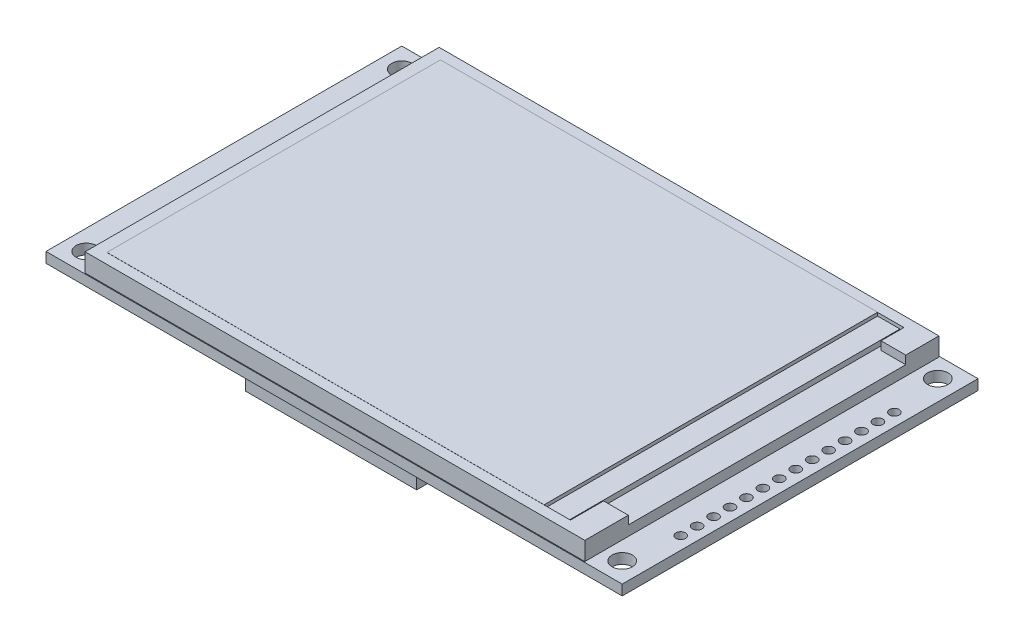
from build123d import *

# Parameters (mm, degrees)
ESQUISSE1_W             = 89.4
ESQUISSE1_H             = 55.2
ESQUISSE1_R             = 1.58
PLAQUE_DEPTH            = 1.6
ESQUISSE2_3_W           = 3.47
ESQUISSE2_3_H           = 51.74
NAPPE_DEPTH             = 2.35
BORDURE_DEPTH           = 2.85
ESQUISSE2_W             = 67.82
ESQUISSE2_H             = 51.74
LCD_DEPTH               = 2.87
SUPPORT_DEPTH           = 1.55
CARTE_SD_DEPTH          = 3
ESQUISSE5_R             = 0.75
ENL_V_MAT_EXTRU_1_DEPTH = 53.735282307


with BuildPart() as part:
    # Esquisse1 → Plaque (new body)
    with BuildSketch(Plane(origin=(0, 0, 0), x_dir=(1, 0, 0), z_dir=(0, 1, 0))):
        Rectangle(ESQUISSE1_W, ESQUISSE1_H)
        with Locations((-41.58, 24.48)):
            Circle(ESQUISSE1_R, mode=Mode.SUBTRACT)
        with Locations((41.58, 24.48)):
            Circle(ESQUISSE1_R, mode=Mode.SUBTRACT)
        with Locations((-41.58, -24.48)):
            Circle(ESQUISSE1_R, mode=Mode.SUBTRACT)
        with Locations((41.58, -24.48)):
            Circle(ESQUISSE1_R, mode=Mode.SUBTRACT)
    extrude(amount=PLAQUE_DEPTH)

    # Esquisse2<3> → Nappe (add)
    with BuildSketch(Plane(origin=(0, 1.6, 0), x_dir=(1, 0, 0), z_dir=(0, 1, 0))):
        with Locations((32.585, 0)):
            Rectangle(ESQUISSE2_3_W, ESQUISSE2_3_H)
    extrude(amount=NAPPE_DEPTH)

    # Esquisse2<5> → Bordure (add)
    with BuildSketch(Plane(origin=(0, 1.6, 0), x_dir=(1, 0, 0), z_dir=(0, 1, 0))):
        Polygon((34.934831333, -20.72), (34.934831333, -25.87), (34.32, -25.87), (30.85, -25.87), (-36.97, -25.87), (-36.97, 25.87), (30.85, 25.87), (34.32, 25.87), (34.934831333, 25.87), (34.934831333, 22.32), (38.77, 22.32), (38.77, 27.47), (-38.77, 27.47), (-38.77, -27.47), (38.77, -27.47), (38.77, -20.72), align=None)
    extrude(amount=BORDURE_DEPTH)

    # Esquisse2 → LCD (add)
    with BuildSketch(Plane(origin=(0, 1.6, 0), x_dir=(1, 0, 0), z_dir=(0, 1, 0))):
        with Locations((-3.06, 0)):
            Rectangle(ESQUISSE2_W, ESQUISSE2_H)
    extrude(amount=LCD_DEPTH)

    # Esquisse2<8> → Support (add)
    with BuildSketch(Plane(origin=(0, 1.6, 0), x_dir=(1, 0, 0), z_dir=(0, 1, 0))):
        Polygon((34.32, -25.87), (34.934831333, -25.87), (34.934831333, -20.72), (38.77, -20.72), (38.77, 22.32), (34.934831333, 22.32), (34.934831333, 25.87), (34.32, 25.87), align=None)
    extrude(amount=SUPPORT_DEPTH)

    # Esquisse4 → Carte SD (add)
    with BuildSketch(Plane.XZ):
        Polygon((-15.04, 26.3), (11.5, 26.3), (11.5, 9.7), (-12.95, 9.7), (-12.95, 15.282856636), (-15.04, 17.558065393), align=None)
    extrude(amount=CARTE_SD_DEPTH)

    # Esquisse5 → Enlèv. mat.-Extru.1 (cut, through all)
    with BuildSketch(Plane(origin=(0, 1.6, 0), x_dir=(1, 0, 0), z_dir=(0, 1, 0))):
        with Locations((42.724707786, 16.6)):
            Circle(ESQUISSE5_R)
        with Locations((42.724707786, 14.05)):
            Circle(ESQUISSE5_R)
        with Locations((42.724707786, 11.5)):
            Circle(ESQUISSE5_R)
        with Locations((42.724707786, 8.95)):
            Circle(ESQUISSE5_R)
        with Locations((42.724707786, 6.4)):
            Circle(ESQUISSE5_R)
        with Locations((42.724707786, 3.85)):
            Circle(ESQUISSE5_R)
        with Locations((42.724707786, 1.3)):
            Circle(ESQUISSE5_R)
        with Locations((42.724707786, -1.25)):
            Circle(ESQUISSE5_R)
        with Locations((42.724707786, -3.8)):
            Circle(ESQUISSE5_R)
        with Locations((42.724707786, -6.35)):
            Circle(ESQUISSE5_R)
        with Locations((42.724707786, -8.9)):
            Circle(ESQUISSE5_R)
        with Locations((42.724707786, -11.45)):
            Circle(ESQUISSE5_R)
        with Locations((42.724707786, -14)):
            Circle(ESQUISSE5_R)
        with Locations((42.724707786, -16.55)):
            Circle(ESQUISSE5_R)
    extrude(amount=-ENL_V_MAT_EXTRU_1_DEPTH, mode=Mode.SUBTRACT)


solid = part.part
